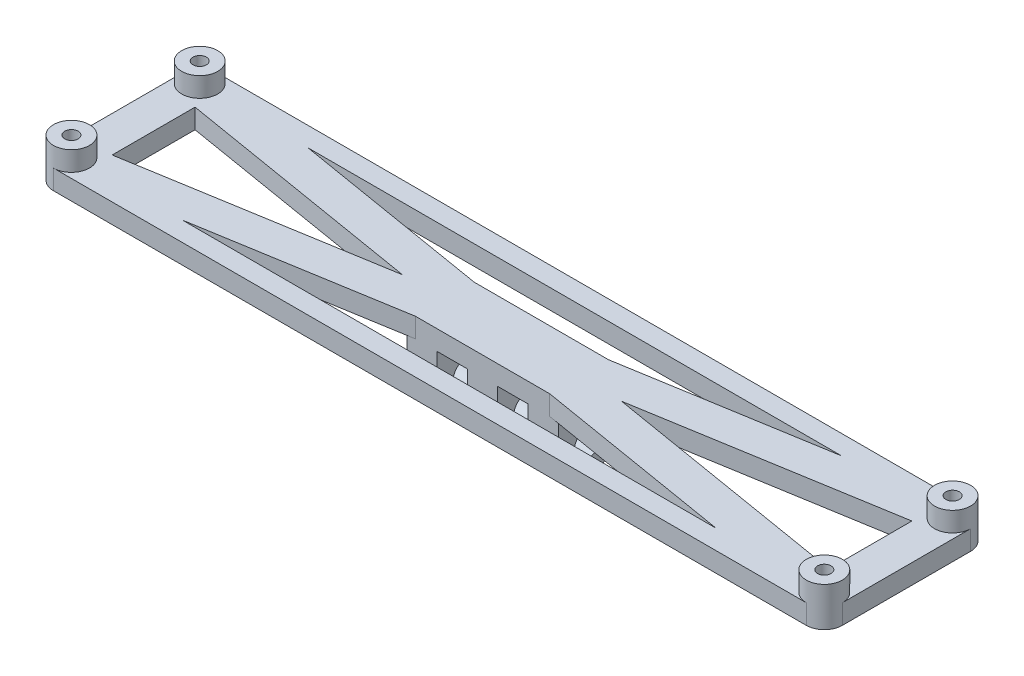
from build123d import *

# Parameters (mm, degrees)
BOSS_EXTRUDE2_DEPTH                        = 2
SKETCH7_R                                  = 1.375
BOSS_EXTRUDE4_DEPTH                        = 3.086
LPATTERN1_COUNT                            = 3
LPATTERN1_PITCH                            = 6.172
SKETCH8_R                                  = 1.835
BOSS_EXTRUDE5_DEPTH                        = 2
SKETCH9_R                                  = 0.685
CUT_EXTRUDE1_DEPTH                         = 43.353925
MIRROR1_AT_THE_SECOND_PLANE_COPY_1_SKETC_R = 1.835
MIRROR1_AT_THE_SECOND_PLANE_COPY_1_DEPTH   = 2
MIRROR1_AT_THE_SECOND_PLANE_COPY_2_SKETC_R = 0.685
MIRROR1_AT_THE_SECOND_PLANE_COPY_2_DEPTH   = 43.353925


with BuildPart() as part:
    # Sketch3 → Boss-Extrude2 (new body)
    with BuildSketch(Plane(origin=(0, 0, 0), x_dir=(1, 0, 0), z_dir=(0, 1, 0))):
        with BuildLine():
            Line((38.36, -8.37), (-38.36, -8.37))
            ThreePointArc((-38.36, -8.37), (-39.657541, -7.832541), (-40.195, -6.535))
            Line((-40.195, -6.535), (-40.195, 6.535))
            ThreePointArc((-40.195, 6.535), (-39.657541, 7.832541), (-38.36, 8.37))
            Line((-38.36, 8.37), (38.36, 8.37))
            ThreePointArc((38.36, 8.37), (39.657541, 7.832541), (40.195, 6.535))
            Line((40.195, 6.535), (40.195, -6.535))
            ThreePointArc((40.195, -6.535), (39.657541, -7.832541), (38.36, -8.37))
        make_face()
        Polygon((6.841855, -3), (27.192466, -6.39), (-27.192466, -6.39), (-6.841855, -3), align=None, mode=Mode.SUBTRACT)
        Polygon((-27.192466, 6.39), (-6.841855, 3), (6.841855, 3), (27.192466, 6.39), align=None, mode=Mode.SUBTRACT)
        Polygon((-36.525, 4.224041), (-36.525, -4.224041), (-11.167534, 0), align=None, mode=Mode.SUBTRACT)
        Polygon((36.525, -4.224041), (11.167534, 0), (36.525, 4.224041), align=None, mode=Mode.SUBTRACT)
    extrude(amount=BOSS_EXTRUDE2_DEPTH)

    # Sketch7 → Boss-Extrude4 (add)
    with BuildSketch(Plane.ZY.offset(-7.715)):
        with BuildLine():
            Line((-3, 0), (3, 0))
            Line((3, 0), (3, -3.4))
            ThreePointArc((3, -3.4), (0, -6.4), (-3, -3.4))
            Line((-3, -3.4), (-3, 0))
        make_face()
        with Locations((0, -3.4)):
            Circle(SKETCH7_R, mode=Mode.SUBTRACT)
    boss_extrude4 = extrude(amount=BOSS_EXTRUDE4_DEPTH)

    # LPattern1: Boss-Extrude4 ×3
    with Locations(*[(-i * LPATTERN1_PITCH, 0, 0) for i in range(1, LPATTERN1_COUNT)]):
        add(boss_extrude4)

    # Sketch8 → Boss-Extrude5 (add)
    with BuildSketch(Plane(origin=(0, 2, 0), x_dir=(1, 0, 0), z_dir=(0, 1, 0))):
        with Locations(Location((-38.36, 6.535, 0), (0, 0, 90))):
            Circle(SKETCH8_R)
    boss_extrude5 = extrude(amount=BOSS_EXTRUDE5_DEPTH)

    # Sketch9 → Cut-Extrude1 (cut, through all)
    with BuildSketch(Plane(origin=(0, 4, 0), x_dir=(1, 0, 0), z_dir=(0, 1, 0))):
        with Locations(Location((-38.36, 6.535, 0), (0, 0, 270))):
            Circle(SKETCH9_R)
    cut_extrude1 = extrude(amount=-CUT_EXTRUDE1_DEPTH, mode=Mode.SUBTRACT)

    # Mirror1: Boss-Extrude5, Cut-Extrude1 across plane
    add(boss_extrude5.mirror(Plane(origin=(0, 0, 0), x_dir=(0, 0, 1), z_dir=(1, 0, 0))))
    add(cut_extrude1.mirror(Plane(origin=(0, 0, 0), x_dir=(0, 0, 1), z_dir=(1, 0, 0))), mode=Mode.SUBTRACT)

    # Mirror1 at the second plane: Boss-Extrude5, Cut-Extrude1 across plane
    add(boss_extrude5.mirror(Plane.XY))
    add(cut_extrude1.mirror(Plane.XY), mode=Mode.SUBTRACT)

    # Mirror1 at the second plane copy 1 sketc → Mirror1 at the second plane copy 1 (add)
    with BuildSketch(Plane(origin=(0, 2, 0), x_dir=(-1, 0, 0), z_dir=(0, 1, 0))):
        with Locations(Location((-38.36, 6.535, 0), (0, 0, 90))):
            Circle(MIRROR1_AT_THE_SECOND_PLANE_COPY_1_SKETC_R)
    extrude(amount=MIRROR1_AT_THE_SECOND_PLANE_COPY_1_DEPTH)

    # Mirror1 at the second plane copy 2 sketc → Mirror1 at the second plane copy 2 (cut, through all)
    with BuildSketch(Plane(origin=(0, 4, 0), x_dir=(-1, 0, 0), z_dir=(0, 1, 0))):
        with Locations(Location((-38.36, 6.535, 0), (0, 0, 270))):
            Circle(MIRROR1_AT_THE_SECOND_PLANE_COPY_2_SKETC_R)
    extrude(amount=-MIRROR1_AT_THE_SECOND_PLANE_COPY_2_DEPTH, mode=Mode.SUBTRACT)


solid = part.part
